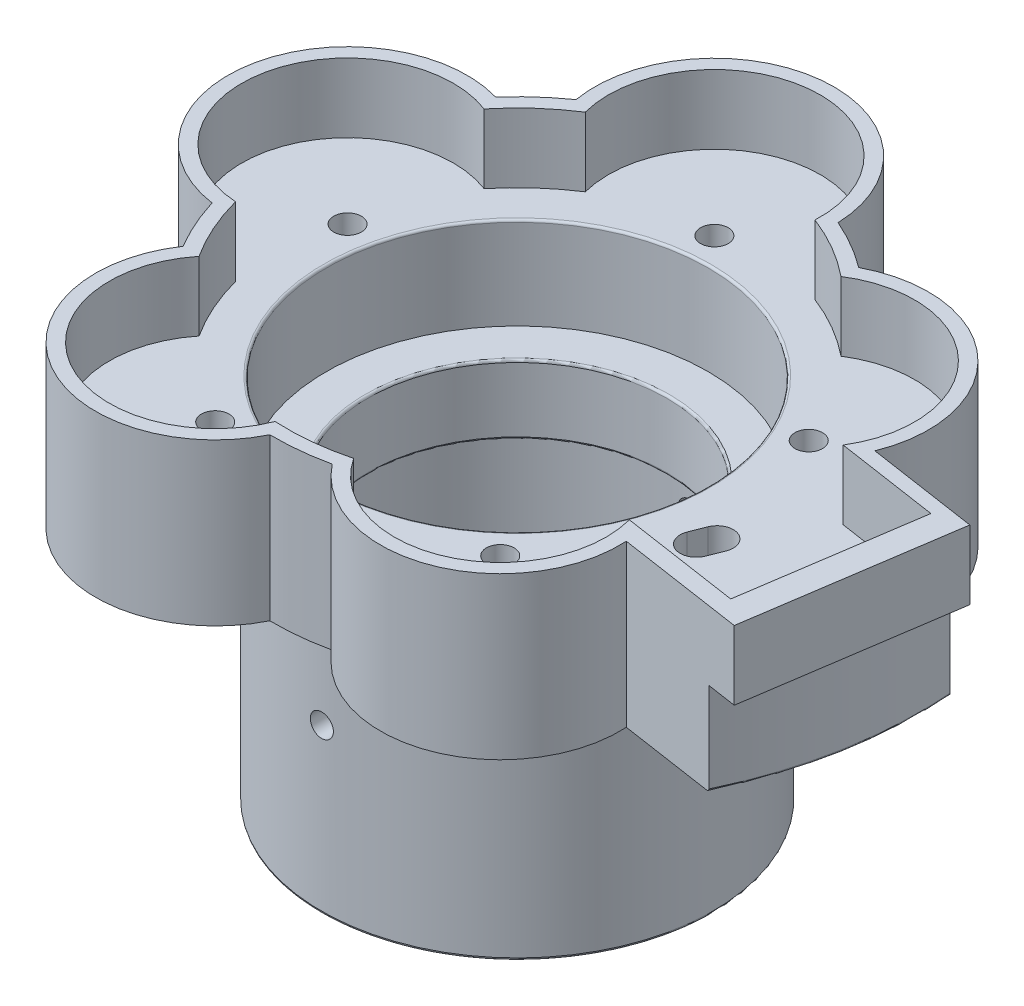
from build123d import *
from build123d.topology import SkipClean

# Parameters (mm, degrees)
CUT_EXTRUDE6_DEPTH      = 148.351620397
CUT_EXTRUDE6_DEPTH_BACK = 148.351620397
SKETCH6_R               = 2.5
SKETCH8_R               = 3
CUT_EXTRUDE8_DEPTH      = 15
CUT_EXTRUDE9_DEPTH      = 148.351620397
BOSS_EXTRUDE1_DEPTH     = 15
CUT_EXTRUDE10_DEPTH     = 151.219366665


with BuildPart() as part:
    # Sketch1 → Revolve1 (revolve)
    with BuildSketch(Plane.XY):
        with BuildLine():
            Line((-87.5, -19.5), (-87.5, 0))
            Line((-87.5, 0), (-42, 0))
            ThreePointArc((-42, 0), (-41.646446609, -0.146446609), (-41.5, -0.5))
            Line((-41.5, -0.5), (-41.5, -20))
            Line((-41.5, -20), (-33, -20))
            ThreePointArc((-33, -20), (-32.646446609, -20.146446609), (-32.5, -20.5))
            Line((-32.5, -20.5), (-32.5, -34.5))
            ThreePointArc((-32.5, -34.5), (-32.646446609, -34.853553391), (-33, -35))
            Line((-33, -35), (-37, -35))
            ThreePointArc((-37, -35), (-37.353553391, -35.146446609), (-37.5, -35.5))
            Line((-37.5, -35.5), (-37.5, -79.5))
            ThreePointArc((-37.5, -79.5), (-37.646446609, -79.853553391), (-38, -80))
            Line((-38, -80), (-42, -80))
            ThreePointArc((-42, -80), (-42.353553391, -79.853553391), (-42.5, -79.5))
            Line((-42.5, -79.5), (-42.5, -25.5))
            ThreePointArc((-42.5, -25.5), (-42.646446609, -25.146446609), (-43, -25))
            Line((-43, -25), (-47, -25))
            ThreePointArc((-47, -25), (-47.353553391, -24.853553391), (-47.5, -24.5))
            Line((-47.5, -24.5), (-47.5, -20.5))
            ThreePointArc((-47.5, -20.5), (-47.646446609, -20.146446609), (-48, -20))
            Line((-48, -20), (-87, -20))
            ThreePointArc((-87, -20), (-87.353553391, -19.853553391), (-87.5, -19.5))
        make_face()
    revolve(axis=Axis((0, -100.5, 0), (0, 1, 0)))

    # Sketch6 → Cut-Extrude6 (cut, two sides: drawn at the far end of the back side and taken through both)
    with BuildSketch(Plane.XY.offset(-CUT_EXTRUDE6_DEPTH_BACK)):
        with Locations((0, -44.5)):
            Circle(SKETCH6_R)
    extrude(amount=CUT_EXTRUDE6_DEPTH + CUT_EXTRUDE6_DEPTH_BACK, mode=Mode.SUBTRACT)

    # Sketch8 → Cut-Extrude8 (cut)
    with BuildSketch(Plane(origin=(0, 0, 0), x_dir=(1, 0, 0), z_dir=(0, 1, 0))):
        with Locations((43.889838941, 19.434043267)):
            Circle(SKETCH8_R)
        with Locations((-4.920167374, 47.747166963)):
            Circle(SKETCH8_R)
        with Locations((-46.930669609, 10.075328782)):
            Circle(SKETCH8_R)
        with Locations((-24.084581559, -41.520271328)):
            Circle(SKETCH8_R)
        with Locations((32.045579601, -35.736267685)):
            Circle(SKETCH8_R)
    extrude(amount=-CUT_EXTRUDE8_DEPTH, mode=Mode.SUBTRACT)

    # Sketch9 → Cut-Extrude9 (cut, through all)
    with BuildSketch(Plane(origin=(0, 0, 0), x_dir=(1, 0, 0), z_dir=(0, 1, 0))):
        with BuildLine():
            Line((47.878654766, -10.959765881), (49.165402635, -7.704880334))
            ThreePointArc((49.165402635, -7.704880334), (53.70703605, -5.736742656), (55.675173729, -10.278376071))
            Line((55.675173729, -10.278376071), (54.38842586, -13.533261618))
            ThreePointArc((54.38842586, -13.533261618), (49.846792445, -15.501399296), (47.878654766, -10.959765881))
        make_face()
    extrude(amount=-CUT_EXTRUDE9_DEPTH, mode=Mode.SUBTRACT)

    # Sketch11 → Boss-Extrude1 (add)
    with BuildSketch(Plane(origin=(0, 0, 0), x_dir=(1, 0, 0), z_dir=(0, 1, 0))):
        with BuildLine():
            Line((58.006112558, -34.30423118), (85.576477812, -38.437086773))
            Line((85.576477812, -38.437086773), (92.247537123, 6.065688058))
            Line((92.247537123, 6.065688058), (67.999162916, 9.700570224))
            ThreePointArc((67.999162916, 9.700570224), (61.316434203, 38.72947738), (31.759074129, 42.430663564))
            ThreePointArc((31.759074129, 42.430663564), (26.593392138, 45.845299591), (21.064699366, 48.634128353))
            ThreePointArc((21.064699366, 48.634128353), (-7.585258035, 73.610215735), (-30.539865442, 43.316470525))
            ThreePointArc((-30.539865442, 43.316470525), (-35.383660809, 39.458795569), (-39.744454599, 35.062491763))
            ThreePointArc((-39.744454599, 35.062491763), (-72.35144898, 15.532798539), (-50.633748984, -15.659612507))
            ThreePointArc((-50.633748984, -15.659612507), (-48.461697164, -21.458422775), (-45.628123172, -26.964316713))
            ThreePointArc((-45.628123172, -26.964316713), (-37.13039657, -64.010418297), (-0.753512408, -52.994643305))
            ThreePointArc((-0.753512408, -52.994643305), (5.432684809, -52.720830188), (11.544723636, -51.727355975))
            ThreePointArc((11.544723636, -51.727355975), (41.174836834, -60.080808395), (58.006112558, -34.30423118))
        make_face()
        with BuildLine():
            Line((54.30452578, -29.944953934), (80.200529182, -33.826819172))
            Line((80.200529182, -33.826819172), (85.869096525, 3.988310978))
            Line((85.869096525, 3.988310978), (63.458218568, 7.347748601))
            ThreePointArc((63.458218568, 7.347748601), (60.031323322, 35.818562851), (31.512479161, 38.819629791))
            ThreePointArc((31.512479161, 38.819629791), (25.08810579, 43.250282633), (18.05255347, 46.62730223))
            ThreePointArc((18.05255347, 46.62730223), (-7.277747575, 70.6260178), (-27.181770278, 41.966073971))
            ThreePointArc((-27.181770278, 41.966073971), (-33.380812084, 37.225278839), (-38.766653809, 31.577627404))
            ThreePointArc((-38.766653809, 31.577627404), (-69.41828213, 14.90309049), (-48.311737067, -12.883169703))
            ThreePointArc((-48.311737067, -12.883169703), (-45.71858223, -20.24379507), (-42.011663154, -27.11125521))
            ThreePointArc((-42.011663154, -27.11125521), (-35.625110222, -61.415401339), (-2.676525285, -49.92831073))
            ThreePointArc((-2.676525285, -49.92831073), (5.125174348, -49.736632253), (12.802018056, -48.333304601))
            ThreePointArc((12.802018056, -48.333304601), (41.362553154, -56.76467713), (54.30452578, -29.944953934))
        make_face(mode=Mode.SUBTRACT)
    extrude(amount=BOSS_EXTRUDE1_DEPTH)

    # Sketch12 → Cut-Extrude10 (cut, through all)
    with SkipClean():  # the faces are left unmerged after this step: merging them gives an invalid solid
        with BuildSketch(Plane(origin=(0, 0, 0), x_dir=(1, 0, 0), z_dir=(0, 1, 0))):
            with BuildLine():
                Line((67.999162916, 9.700570224), (87.234026964, 6.817223749))
                ThreePointArc((87.234026964, 6.817223749), (-86.05128608, 15.856423429), (79.074736383, -37.462462092))
                Line((79.074736383, -37.462462092), (58.006112558, -34.30423118))
                ThreePointArc((58.006112558, -34.30423118), (41.174836834, -60.080808395), (11.544723636, -51.727355975))
                ThreePointArc((11.544723636, -51.727355975), (5.432684809, -52.720830188), (-0.753512408, -52.994643305))
                ThreePointArc((-0.753512408, -52.994643305), (-37.13039657, -64.010418297), (-45.628123172, -26.964316713))
                ThreePointArc((-45.628123172, -26.964316713), (-48.461697164, -21.458422775), (-50.633748984, -15.659612507))
                ThreePointArc((-50.633748984, -15.659612507), (-72.35144898, 15.532798539), (-39.744454599, 35.062491763))
                ThreePointArc((-39.744454599, 35.062491763), (-35.383660809, 39.458795569), (-30.539865442, 43.316470525))
                ThreePointArc((-30.539865442, 43.316470525), (-7.585258035, 73.610215735), (21.064699366, 48.634128353))
                ThreePointArc((21.064699366, 48.634128353), (26.593392138, 45.845299591), (31.759074129, 42.430663564))
                ThreePointArc((31.759074129, 42.430663564), (61.316434203, 38.72947738), (67.999162916, 9.700570224))
            make_face()
        extrude(amount=-CUT_EXTRUDE10_DEPTH, mode=Mode.SUBTRACT)


solid = part.part
